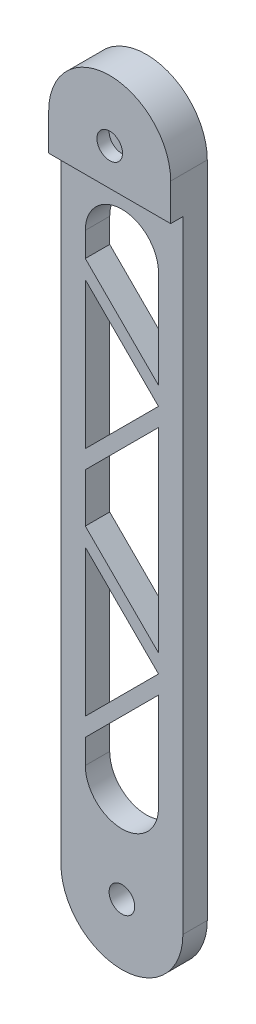
from build123d import *

# Parameters (mm, degrees)
CROQUIS1_R              = 2.1
SALIENTE_EXTRUIR1_DEPTH = 4
CROQUIS1_6_R            = 2.1
SALIENTE_EXTRUIR3_DEPTH = 6


with BuildPart() as part:
    # Croquis1 → Saliente-Extruir1 (new body)
    with BuildSketch(Plane.XY):
        with BuildLine():
            ThreePointArc((10, 54), (0, 64), (-10, 54))
            Line((-10, 54), (-10, -54))
            ThreePointArc((-10, -54), (0, -64), (10, -54))
            Line((10, -54), (10, 54))
        make_face()
        with BuildLine():
            Line((6, 38), (6, 22))
            Line((6, 22), (-6, 34))
            Line((-6, 34), (-6, 38))
            ThreePointArc((-6, 38), (0, 44), (6, 38))
        make_face(mode=Mode.SUBTRACT)
        Polygon((-6, 7), (-6, 31), (6, 19), align=None, mode=Mode.SUBTRACT)
        Polygon((-6, -4), (-6, 4), (6, 16), (6, -16), align=None, mode=Mode.SUBTRACT)
        Polygon((-6, -31), (-6, -7), (6, -19), align=None, mode=Mode.SUBTRACT)
        with BuildLine():
            Line((-6, -38), (-6, -34))
            Line((-6, -34), (6, -22))
            Line((6, -22), (6, -38))
            ThreePointArc((6, -38), (0, -44), (-6, -38))
        make_face(mode=Mode.SUBTRACT)
        with Locations((0, -54)):
            Circle(CROQUIS1_R, mode=Mode.SUBTRACT)
    extrude(amount=SALIENTE_EXTRUIR1_DEPTH)

    # Croquis1<6> → Saliente-Extruir3 (add)
    with BuildSketch(Plane.XY):
        with BuildLine():
            Line((10, 47.95), (10, 54))
            ThreePointArc((10, 54), (0, 64), (-10, 54))
            Line((-10, 54), (-10, 47.95))
            Line((-10, 47.95), (10, 47.95))
        make_face()
        with Locations((0, 54)):
            Circle(CROQUIS1_6_R, mode=Mode.SUBTRACT)
    extrude(amount=SALIENTE_EXTRUIR3_DEPTH)


solid = part.part
